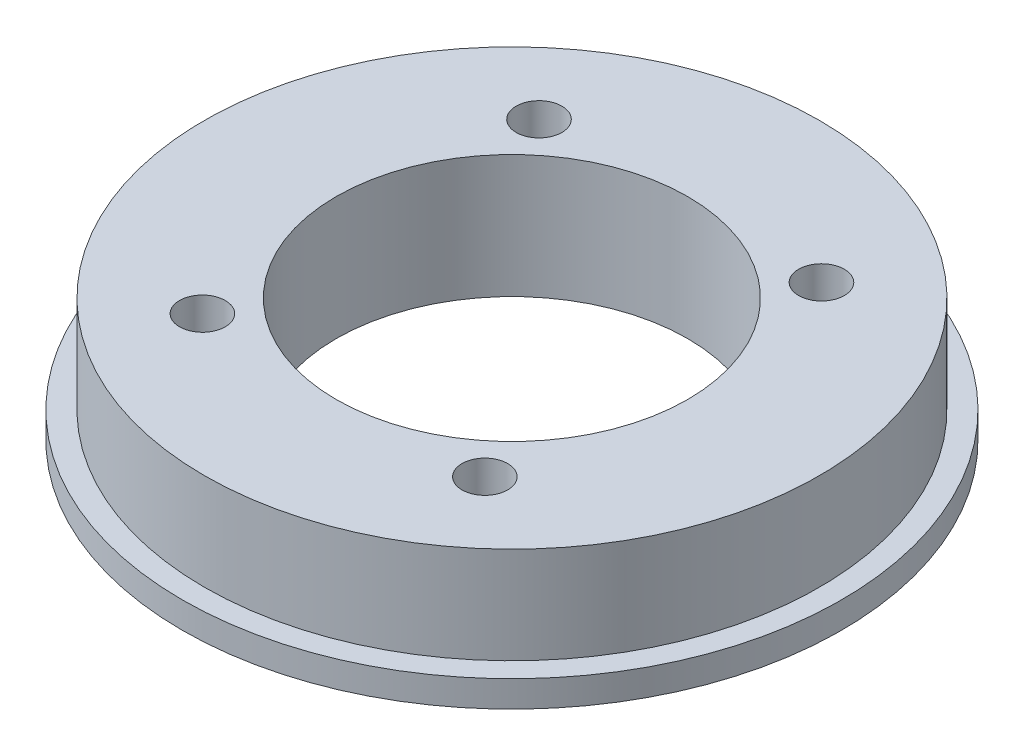
from build123d import *

# Parameters (mm, degrees)
SKETCH1_R           = 37.5
BOSS_EXTRUDE1_DEPTH = 3
SKETCH2_R           = 35
BOSS_EXTRUDE2_DEPTH = 11
SKETCH4_R           = 2.6
CUT_EXTRUDE2_DEPTH  = 55.849794895
SKETCH5_R           = 20
CUT_EXTRUDE3_DEPTH  = 55.849794895
SKETCH6_R           = 4.75
CUT_EXTRUDE4_DEPTH  = 3


with BuildPart() as part:
    # Sketch1 → Boss-Extrude1 (new body)
    with BuildSketch(Plane(origin=(0, 0, 0), x_dir=(1, 0, 0), z_dir=(0, 1, 0))):
        with Locations(Location((0, 0, 0), (0, 0, 270))):
            Circle(SKETCH1_R)
    extrude(amount=BOSS_EXTRUDE1_DEPTH)

    # Sketch2 → Boss-Extrude2 (add)
    with BuildSketch(Plane(origin=(0, 3, 0), x_dir=(1, 0, 0), z_dir=(0, 1, 0))):
        with Locations(Location((0, 0, 0), (0, 0, 270))):
            Circle(SKETCH2_R)
    extrude(amount=BOSS_EXTRUDE2_DEPTH)

    # Sketch4 → Cut-Extrude2 (cut, through all)
    with BuildSketch(Plane(origin=(0, 14, 0), x_dir=(1, 0, 0), z_dir=(0, 1, 0))):
        with Locations(Location((-16.069690242, 19.151111078, 0), (0, 0, 270))):
            Circle(SKETCH4_R)
        with Locations(Location((16.069690242, 19.151111078, 0), (0, 0, 270))):
            Circle(SKETCH4_R)
        with Locations(Location((16.069690242, -19.151111078, 0), (0, 0, 270))):
            Circle(SKETCH4_R)
        with Locations(Location((-16.069690242, -19.151111078, 0), (0, 0, 270))):
            Circle(SKETCH4_R)
    extrude(amount=-CUT_EXTRUDE2_DEPTH, mode=Mode.SUBTRACT)

    # Sketch5 → Cut-Extrude3 (cut, through all)
    with BuildSketch(Plane(origin=(0, 14, 0), x_dir=(1, 0, 0), z_dir=(0, 1, 0))):
        with Locations(Location((0, 0, 0), (0, 0, 270))):
            Circle(SKETCH5_R)
    extrude(amount=-CUT_EXTRUDE3_DEPTH, mode=Mode.SUBTRACT)

    # Sketch6 → Cut-Extrude4 (cut)
    with BuildSketch(Plane.XZ):
        with Locations(Location((16.069690242, -19.151111078, 0), (0, 0, 270))):
            Circle(SKETCH6_R)
        with Locations(Location((-16.069690242, -19.151111078, 0), (0, 0, 270))):
            Circle(SKETCH6_R)
        with Locations(Location((16.069690242, 19.151111078, 0), (0, 0, 270))):
            Circle(SKETCH6_R)
        with Locations(Location((-16.069690242, 19.151111078, 0), (0, 0, 270))):
            Circle(SKETCH6_R)
    extrude(amount=-CUT_EXTRUDE4_DEPTH, mode=Mode.SUBTRACT)


solid = part.part
